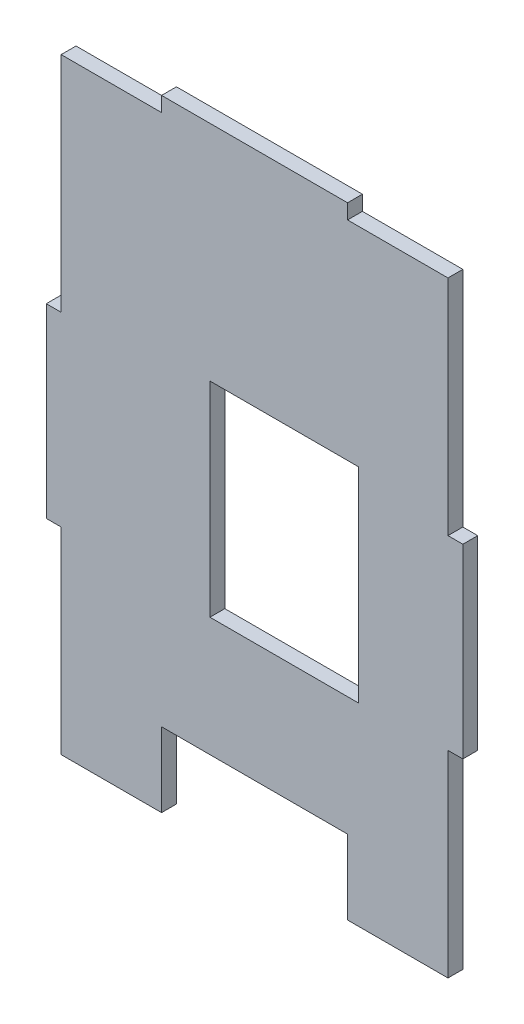
from build123d import *

# Parameters (mm, degrees)
SKETCH_2_W          = 112
SKETCH_2_H          = 172
EXTRUDE_1_DEPTH     = 4
SKETCH_3_W          = 27
SKETCH_3_H          = 4
SKETCH_3_W_2        = 4
SKETCH_3_H_2        = 58
CUT_EXTRUDE_2_DEPTH = 4
SKETCH_5_W          = 104
SKETCH_5_H          = 5
CUT_EXTRUDE_4_DEPTH = 4
SKETCH_6_W          = 40
SKETCH_6_H          = 55
CUT_EXTRUDE_5_DEPTH = 4
SKETCH_8_W          = 50
SKETCH_8_H          = 20
CUT_EXTRUDE_6_DEPTH = 4


with BuildPart() as part:
    # 스케치2 → 보스-돌출1 (new body)
    with BuildSketch(Plane.XY):
        with Locations((56, 1)):
            Rectangle(SKETCH_2_W, SKETCH_2_H)
    extrude(amount=-EXTRUDE_1_DEPTH)

    # 스케치3 → 컷-돌출2 (cut)
    with BuildSketch(Plane.XY):
        with Locations((94.5, 85)):
            Rectangle(SKETCH_3_W, SKETCH_3_H)
        Polygon((112, 23), (112, 87), (108, 87), (108, 83), (108, 23), align=None)
        with Locations((17.5, 85)):
            Rectangle(SKETCH_3_W, SKETCH_3_H)
        Polygon((4, 83), (4, 87), (0, 87), (0, 23), (4, 23), align=None)
        with Locations((2, -56)):
            Rectangle(SKETCH_3_W_2, SKETCH_3_H_2)
        with Locations((110, -56)):
            Rectangle(SKETCH_3_W_2, SKETCH_3_H_2)
    extrude(amount=-CUT_EXTRUDE_2_DEPTH, mode=Mode.SUBTRACT)

    # 스케치5 → 컷-돌출4 (cut)
    with BuildSketch(Plane.XY):
        with Locations((56, -82.5)):
            Rectangle(SKETCH_5_W, SKETCH_5_H)
    extrude(amount=-CUT_EXTRUDE_4_DEPTH, mode=Mode.SUBTRACT)

    # 스케치6 → 컷-돌출5 (cut)
    with BuildSketch(Plane.XY):
        with Locations((64, -0.5)):
            Rectangle(SKETCH_6_W, SKETCH_6_H)
    extrude(amount=-CUT_EXTRUDE_5_DEPTH, mode=Mode.SUBTRACT)

    # 스케치8 → 컷-돌출6 (cut)
    with BuildSketch(Plane.XY):
        with Locations((56, -70)):
            Rectangle(SKETCH_8_W, SKETCH_8_H)
    extrude(amount=-CUT_EXTRUDE_6_DEPTH, mode=Mode.SUBTRACT)


solid = part.part
